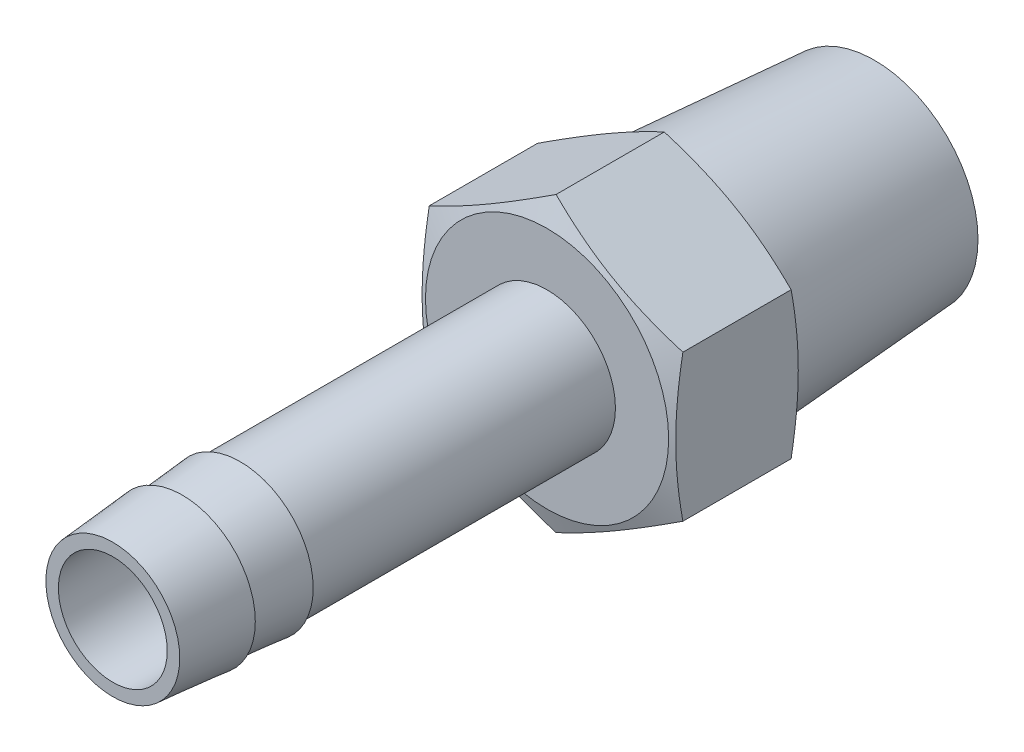
from build123d import *

# Parameters (mm, degrees)
SKETCH2_OUTSIDE_W  = 25.78
SKETCH2_OUTSIDE_H  = 25.78
CUT_EXTRUDE1_DEPTH = 27.994890987


with BuildPart() as part:
    # Sketch1 → Revolve1 (revolve)
    with BuildSketch(Plane(origin=(0, 0, 0), x_dir=(0, 0, -1), z_dir=(1, 0, 0)), mode=Mode.PRIVATE) as revolve1_sk:
        Polygon((-4.127129718, 2.3876), (-24.591144492, 2.3876), (-24.591144492, 2.936534554), (-21.543144492, 3.2032), (-21.523850338, 2.982666814), (-19.003144492, 3.2032), (-18.985366795, 3), (-5.541144492, 3), (-5.541144492, 5.334), (-4.616660097, 7.874), (-0.924484395, 7.874), (0, 5.334), (0, 5.1562), (8.825478894, 4.539062397), (8.825478894, 2.5781), (-4.017144492, 2.5781), align=None)
    revolve(revolve1_sk.sketch.rotate(Axis((0, 0, -2.001994087), (0, 0, -1)), 90), axis=Axis((0, 0, -2.001994087), (0, 0, -1)))

    # Sketch2 outside → Cut-Extrude1 (cut, through all)
    with BuildSketch(Plane.XY):
        Rectangle(SKETCH2_OUTSIDE_W, SKETCH2_OUTSIDE_H)
        Polygon((0, 6.423137215), (-5.5626, 3.211568607), (-5.5626, -3.211568607), (0, -6.423137215), (5.5626, -3.211568607), (5.5626, 3.211568607), align=None, mode=Mode.SUBTRACT)
    extrude(amount=CUT_EXTRUDE1_DEPTH, mode=Mode.SUBTRACT)


solid = part.part
